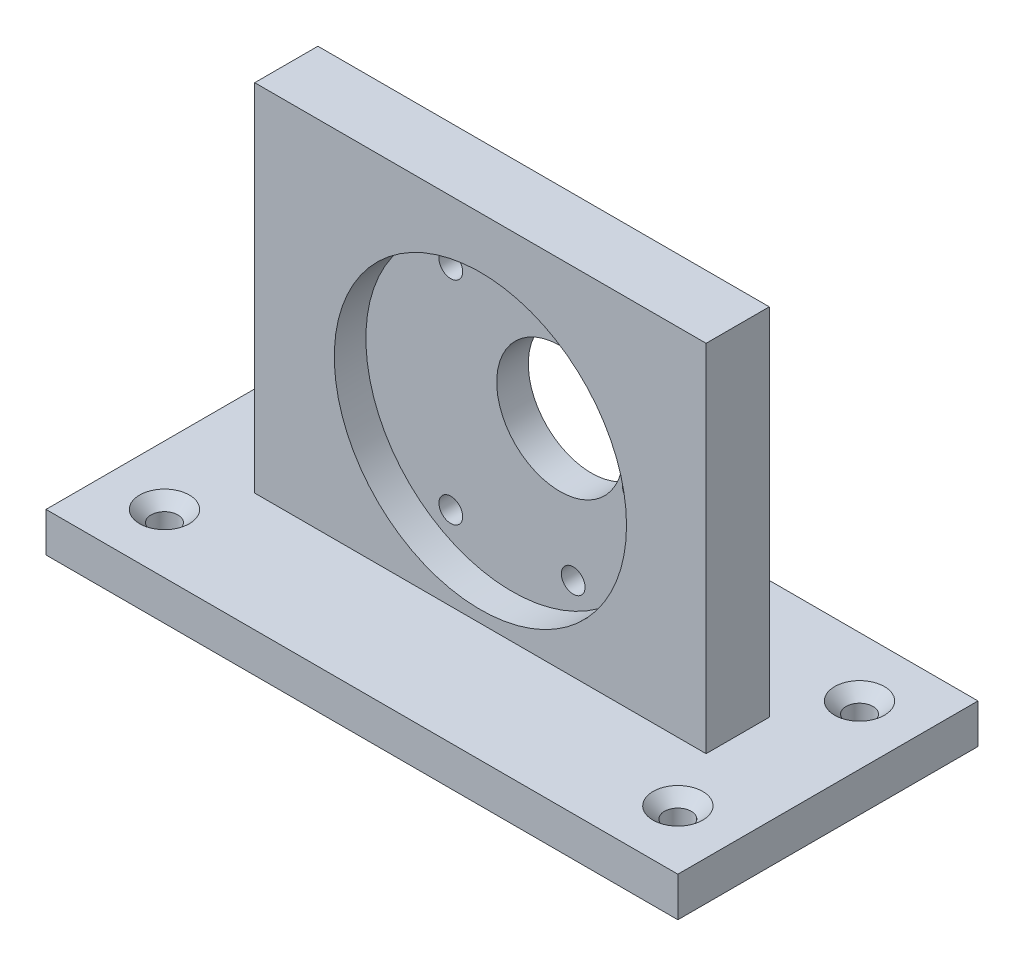
from build123d import *

# Parameters (mm, degrees)
SKETCH3_W                                       = 57.15
SKETCH3_H                                       = 50
BOSS_EXTRUDE1_DEPTH                             = 8
SKETCH3_3_R                                     = 1.5
SKETCH3_3_R_2                                   = 8
CUT_EXTRUDE2_DEPTH                              = 10
SKETCH4_R                                       = 18.5
CUT_EXTRUDE3_DEPTH                              = 4
BOSS_EXTRUDE2_DEPTH                             = 15
BOSS_EXTRUDE2_DEPTH_BACK                        = 23
SKETCH6_W                                       = 80
SKETCH6_H                                       = 5
CSK_FOR_M3_FLAT_HEAD_MACHINE_SCREW1_D           = 3.4
CSK_FOR_M3_FLAT_HEAD_MACHINE_SCREW1_CSINK_D     = 6.3
CSK_FOR_M3_FLAT_HEAD_MACHINE_SCREW1_CSINK_ANGLE = 90
BOSS_EXTRUDE4_DEPTH                             = 2.54


with BuildPart() as part:
    # Sketch3 → Boss-Extrude1 (new body)
    with BuildSketch(Plane.XY):
        with Locations((0, 25)):
            Rectangle(SKETCH3_W, SKETCH3_H)
    extrude(amount=BOSS_EXTRUDE1_DEPTH)

    # Sketch3<3> → Cut-Extrude2 (cut)
    with BuildSketch(Plane.XY):
        with Locations((-7.75, 38.423393759)):
            Circle(SKETCH3_3_R)
        with Locations((7.75, 38.423393759)):
            Circle(SKETCH3_3_R)
        with Locations((-7.75, 11.576606241)):
            Circle(SKETCH3_3_R)
        with Locations((7.75, 11.576606241)):
            Circle(SKETCH3_3_R)
        with Locations((15.5, 25)):
            Circle(SKETCH3_3_R)
        with Locations((6.062177825, 28.499999999)):
            Circle(SKETCH3_3_R_2)
    extrude(amount=CUT_EXTRUDE2_DEPTH, mode=Mode.SUBTRACT)

    # Sketch4 → Cut-Extrude3 (cut)
    with BuildSketch(Plane.XY.offset(8)):
        with Locations((0, 25)):
            Circle(SKETCH4_R)
    extrude(amount=-CUT_EXTRUDE3_DEPTH, mode=Mode.SUBTRACT)

    # Sketch6 → Boss-Extrude2 (add, two sides: drawn at the far end of the back side and taken through both)
    with BuildSketch(Plane.XY.offset(8).offset(-BOSS_EXTRUDE2_DEPTH_BACK)):
        with Locations((0, 2.5)):
            Rectangle(SKETCH6_W, SKETCH6_H)
    extrude(amount=BOSS_EXTRUDE2_DEPTH + BOSS_EXTRUDE2_DEPTH_BACK)

    # CSK for M3 Flat Head Machine Screw1 (through all)
    with Locations(Plane(origin=(0, 5, 0), x_dir=(1, 0, 0), z_dir=(0, 1, 0))):
        with Locations((-32.5, 7.5), (-32.5, -15.5), (32.5, -15.5), (32.5, 7.5)):
            CounterSinkHole(CSK_FOR_M3_FLAT_HEAD_MACHINE_SCREW1_D / 2, CSK_FOR_M3_FLAT_HEAD_MACHINE_SCREW1_CSINK_D / 2, counter_sink_angle=CSK_FOR_M3_FLAT_HEAD_MACHINE_SCREW1_CSINK_ANGLE)

    # Sketch13 → Boss-Extrude4 (add)
    with BuildSketch(Plane(origin=(0, 0, 0), x_dir=(-1, 0, 0), z_dir=(0, 0, -1))):
        with BuildLine():
            Line((20.564, 22.023), (12.944, 22.023))
            ThreePointArc((12.944, 22.023), (6.467, 28.5), (12.944, 34.977))
            Line((12.944, 34.977), (20.564, 34.977))
            ThreePointArc((20.564, 34.977), (27.041, 28.5), (20.564, 22.023))
        make_face()
        with BuildLine():
            Line((20.564, 23.293), (12.944, 23.293))
            ThreePointArc((12.944, 23.293), (7.737, 28.5), (12.944, 33.707))
            Line((12.944, 33.707), (20.564, 33.707))
            ThreePointArc((20.564, 33.707), (25.771, 28.5), (20.564, 23.293))
        make_face(mode=Mode.SUBTRACT)
    extrude(amount=BOSS_EXTRUDE4_DEPTH)


solid = part.part
